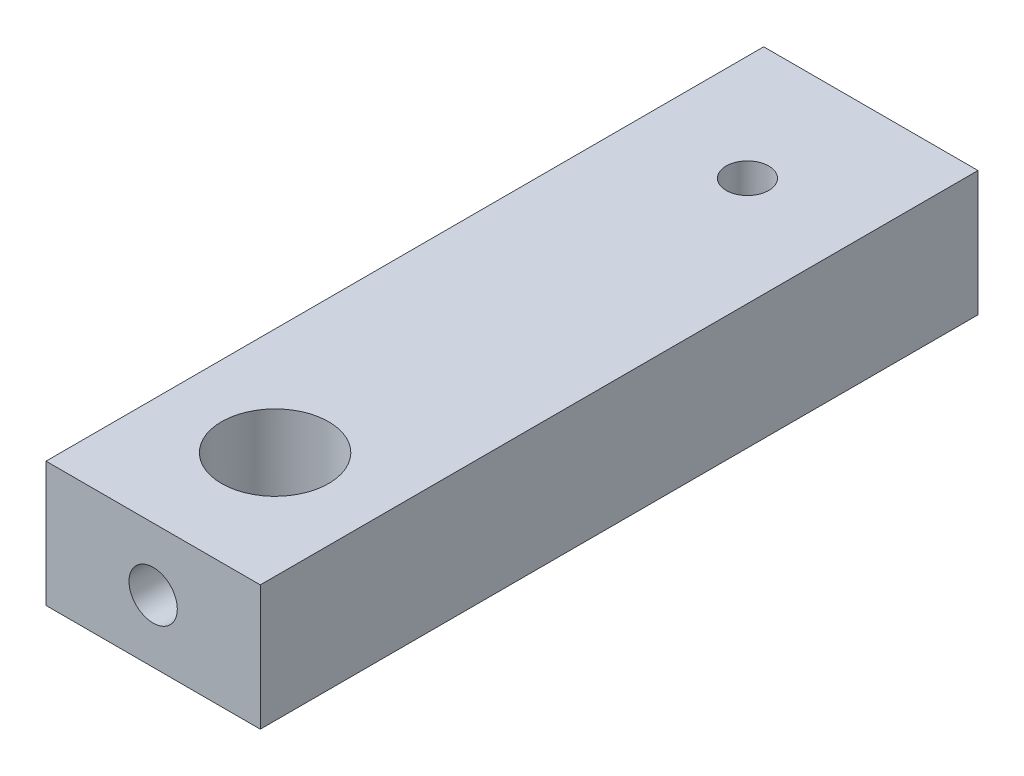
from build123d import *

# Parameters (mm, degrees)
SKETCH9_W                           = 12
SKETCH9_H                           = 40.19
EXTRUDE3_DEPTH                      = 7
F_3_32_0_09375_DIAMETER_HOLE1_D     = 2.38125
F_3_32_0_09375_DIAMETER_HOLE1_DEPTH = 10
F_3_32_0_09375_DIAMETER_HOLE1_TIP   = 0.715399675
F_6_0_6_DIAMETER_HOLE1_D            = 6
F_6_0_6_DIAMETER_HOLE1_DEPTH        = 10
F_6_0_6_DIAMETER_HOLE1_TIP          = 1.802581857
F_6_32_TAPPED_HOLE2_D               = 2.7051
F_6_32_TAPPED_HOLE2_DEPTH           = 7.9624
F_6_32_TAPPED_HOLE2_TIP             = 0.81269403
F_6_32_TAPPED_HOLE1_D               = 2.7051
F_6_32_TAPPED_HOLE1_DEPTH           = 9.96
F_6_32_TAPPED_HOLE1_TIP             = 0.81269403


with BuildPart() as part:
    # Sketch9 → Extrude3 (new body)
    with BuildSketch(Plane(origin=(0, 0, 0), x_dir=(1, 0, 0), z_dir=(0, 1, 0))):
        Rectangle(SKETCH9_W, SKETCH9_H)
    extrude(amount=EXTRUDE3_DEPTH)

    # 3/32 (0.09375) Diameter Hole1
    with Locations(Plane(origin=(-0.08113915, 7, -13.266251032), x_dir=(0, 0, 1), z_dir=(0, 1, 0))):
        with Locations((0, 0)):
            Hole(F_3_32_0_09375_DIAMETER_HOLE1_D / 2, depth=F_3_32_0_09375_DIAMETER_HOLE1_DEPTH)
            with Locations((0, 0, -(F_3_32_0_09375_DIAMETER_HOLE1_DEPTH + F_3_32_0_09375_DIAMETER_HOLE1_TIP / 2))):  # 118° drill point
                Cone(0, F_3_32_0_09375_DIAMETER_HOLE1_D / 2, F_3_32_0_09375_DIAMETER_HOLE1_TIP, mode=Mode.SUBTRACT)

    # Ø6.0 (6) Diameter Hole1
    with Locations(Plane(origin=(0, 7, 13.266499161), x_dir=(0, 0, 1), z_dir=(0, 1, 0))):
        with Locations((0, 0)):
            Hole(F_6_0_6_DIAMETER_HOLE1_D / 2, depth=F_6_0_6_DIAMETER_HOLE1_DEPTH)
            with Locations((0, 0, -(F_6_0_6_DIAMETER_HOLE1_DEPTH + F_6_0_6_DIAMETER_HOLE1_TIP / 2))):  # 118° drill point
                Cone(0, F_6_0_6_DIAMETER_HOLE1_D / 2, F_6_0_6_DIAMETER_HOLE1_TIP, mode=Mode.SUBTRACT)

    # #6-32 Tapped Hole2
    with Locations(Plane(origin=(0, 3.5, 20.095), x_dir=(1, 0, 0), z_dir=(0, 0, 1))):
        with Locations((0, 0)):
            Hole(F_6_32_TAPPED_HOLE2_D / 2, depth=F_6_32_TAPPED_HOLE2_DEPTH)
            with Locations((0, 0, -(F_6_32_TAPPED_HOLE2_DEPTH + F_6_32_TAPPED_HOLE2_TIP / 2))):  # 118° drill point
                Cone(0, F_6_32_TAPPED_HOLE2_D / 2, F_6_32_TAPPED_HOLE2_TIP, mode=Mode.SUBTRACT)

    # #6-32 Tapped Hole1
    with Locations(Plane(origin=(0, 3.5, -20.095), x_dir=(-1, 0, 0), z_dir=(0, 0, -1))):
        with Locations((0, 0)):
            Hole(F_6_32_TAPPED_HOLE1_D / 2, depth=F_6_32_TAPPED_HOLE1_DEPTH)
            with Locations((0, 0, -(F_6_32_TAPPED_HOLE1_DEPTH + F_6_32_TAPPED_HOLE1_TIP / 2))):  # 118° drill point
                Cone(0, F_6_32_TAPPED_HOLE1_D / 2, F_6_32_TAPPED_HOLE1_TIP, mode=Mode.SUBTRACT)


solid = part.part
